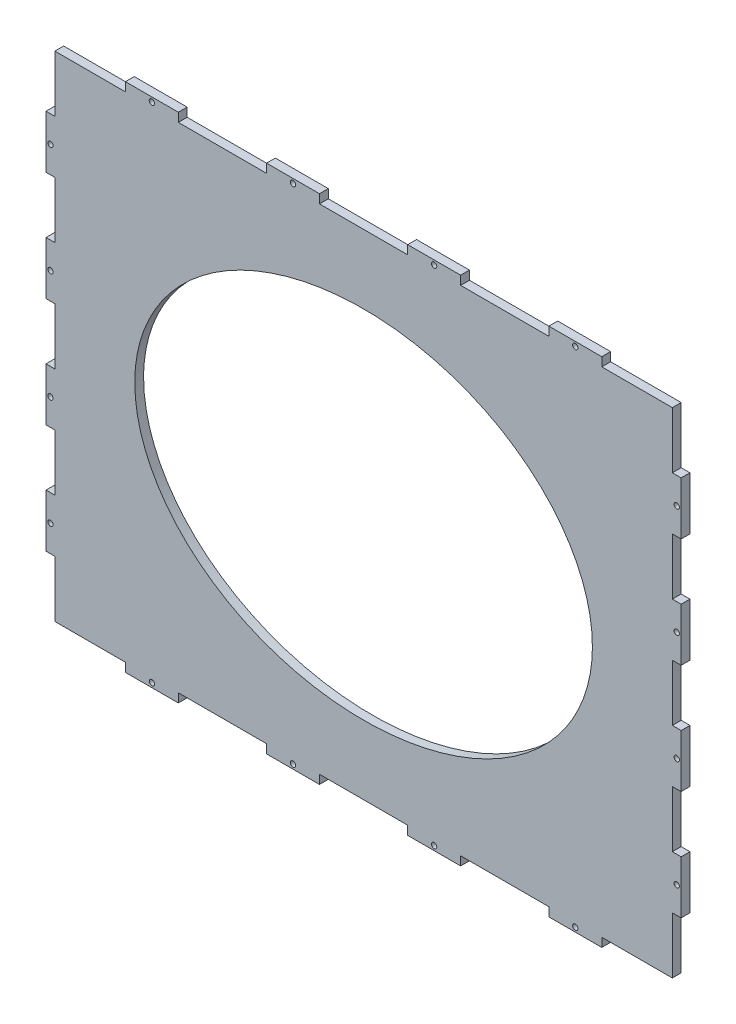
from build123d import *

# Parameters (mm, degrees)
SKETCH1_R           = 1.5
SKETCH1_RX          = 129.696010234
SKETCH1_RY          = 100.962749524
BOSS_EXTRUDE1_DEPTH = 5


with BuildPart() as part:
    # Sketch1 → Boss-Extrude1 (new body)
    with BuildSketch(Plane.XY):
        Polygon((155.509699879, -163.878323363), (115.509699879, -163.878323363), (115.509699879, -168.878323363), (85.509699879, -168.878323363), (85.509699879, -163.878323363), (35.509699879, -163.878323363), (35.509699879, -168.878323363), (5.509699879, -168.878323363), (5.509699879, -163.878323363), (-44.490300121, -163.878323363), (-44.490300121, -168.878323363), (-74.490300121, -168.878323363), (-74.490300121, -163.878323363), (-124.490300121, -163.878323363), (-124.490300121, -168.878323363), (-154.490300121, -168.878323363), (-154.490300121, -163.878323363), (-194.490300121, -163.878323363), (-194.490300121, -131.87832215), (-199.490300121, -131.87832215), (-199.490300121, -101.87832215), (-194.490300121, -101.87832215), (-194.490300121, -69.878320937), (-199.490300121, -69.878320937), (-199.490300121, -39.878320937), (-194.490300121, -39.878320937), (-194.490300121, -7.878319723), (-199.490300121, -7.878319723), (-199.490300121, 22.121680277), (-194.490300121, 22.121680277), (-194.490300121, 54.12168149), (-199.490300121, 54.12168149), (-199.490300121, 84.12168149), (-194.490300121, 84.12168149), (-194.490300121, 116.121682703), (-154.490300121, 116.121682703), (-154.490300121, 121.121682703), (-124.490300121, 121.121682703), (-124.490300121, 116.121682703), (-74.490300121, 116.121682703), (-74.490300121, 121.121682703), (-44.490300121, 121.121682703), (-44.490300121, 116.121682703), (5.509699879, 116.121682703), (5.509699879, 121.121682703), (35.509699879, 121.121682703), (35.509699879, 116.121682703), (85.509699879, 116.121682703), (85.509699879, 121.121682703), (115.509699879, 121.121682703), (115.509699879, 116.121682703), (155.509699879, 116.121682703), (155.509699879, 84.12168149), (160.509699879, 84.12168149), (160.509699879, 54.12168149), (155.509699879, 54.12168149), (155.509699879, 22.121680277), (160.509699879, 22.121680277), (160.509699879, -7.878319723), (155.509699879, -7.878319723), (155.509699879, -39.878320937), (160.509699879, -39.878320937), (160.509699879, -69.878320937), (155.509699879, -69.878320937), (155.509699879, -101.87832215), (160.509699879, -101.87832215), (160.509699879, -131.87832215), (155.509699879, -131.87832215), align=None)
        with Locations((-139.490300121, 118.621682703)):
            Circle(SKETCH1_R, mode=Mode.SUBTRACT)
        with Locations((-59.490300121, 118.621682703)):
            Circle(SKETCH1_R, mode=Mode.SUBTRACT)
        with Locations((-196.990300121, 69.12168149)):
            Circle(SKETCH1_R, mode=Mode.SUBTRACT)
        with Locations((-196.990300121, 7.121680277)):
            Circle(SKETCH1_R, mode=Mode.SUBTRACT)
        with Locations(Location((158.009699879, 7.121680277, 0), (0, 0, 180))):
            Circle(SKETCH1_R, mode=Mode.SUBTRACT)
        with Locations(Location((158.009699879, 69.12168149, 0), (0, 0, 180))):
            Circle(SKETCH1_R, mode=Mode.SUBTRACT)
        with Locations(Location((100.509699879, 118.621682703, 0), (0, 0, 180))):
            Circle(SKETCH1_R, mode=Mode.SUBTRACT)
        with Locations(Location((20.509699879, 118.621682703, 0), (0, 0, 180))):
            Circle(SKETCH1_R, mode=Mode.SUBTRACT)
        with Locations((158.009699879, -54.878320937)):
            Circle(SKETCH1_R, mode=Mode.SUBTRACT)
        with Locations((158.009699879, -116.87832215)):
            Circle(SKETCH1_R, mode=Mode.SUBTRACT)
        with Locations((100.509699879, -166.378323363)):
            Circle(SKETCH1_R, mode=Mode.SUBTRACT)
        with Locations((20.509699879, -166.378323363)):
            Circle(SKETCH1_R, mode=Mode.SUBTRACT)
        with Locations(Location((-59.490300121, -166.378323363, 0), (0, 0, 180))):
            Circle(SKETCH1_R, mode=Mode.SUBTRACT)
        with Locations(Location((-139.490300121, -166.378323363, 0), (0, 0, 180))):
            Circle(SKETCH1_R, mode=Mode.SUBTRACT)
        with Locations(Location((-196.990300121, -54.878320937, 0), (0, 0, 180))):
            Circle(SKETCH1_R, mode=Mode.SUBTRACT)
        with Locations(Location((-196.990300121, -116.87832215, 0), (0, 0, 180))):
            Circle(SKETCH1_R, mode=Mode.SUBTRACT)
        with Locations(Location((-19.490300121, -23.87832033), (0, 0, -180))):
            Ellipse(SKETCH1_RX, SKETCH1_RY, mode=Mode.SUBTRACT)
    extrude(amount=BOSS_EXTRUDE1_DEPTH)


solid = part.part
